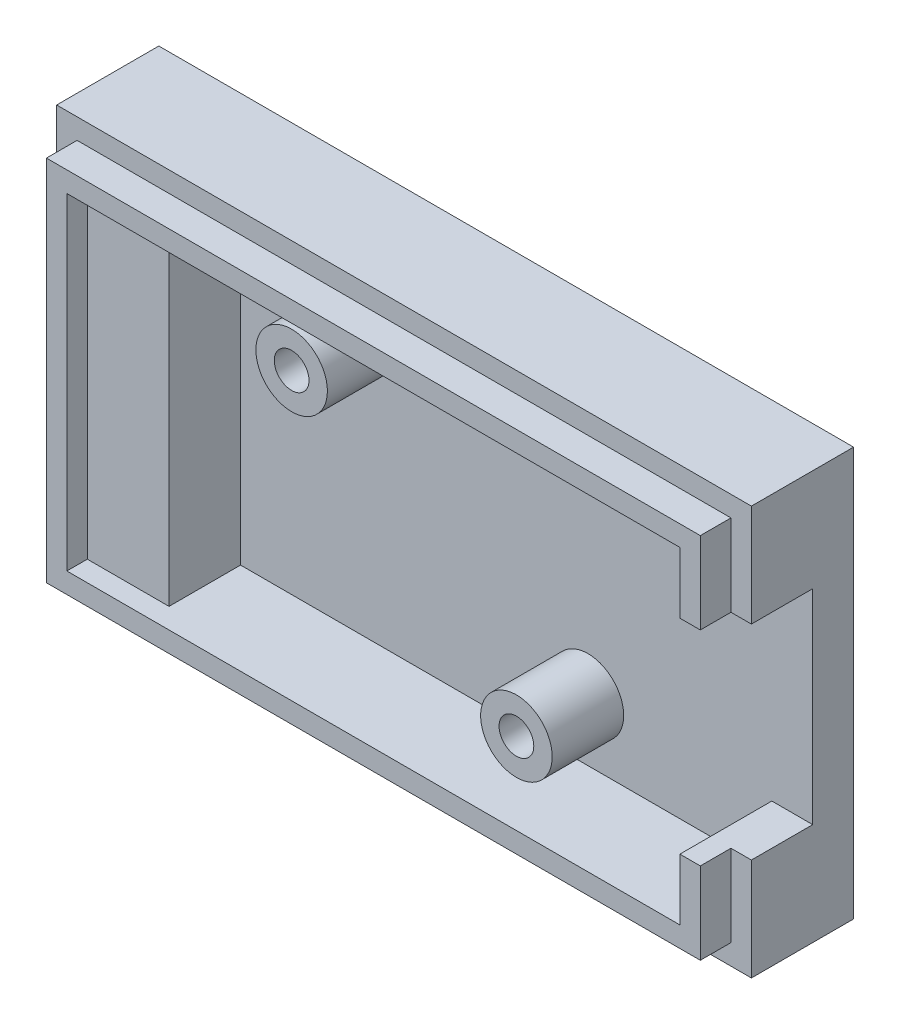
from build123d import *

# Parameters (mm, degrees)
SKETCH_1_W          = 34
SKETCH_1_H          = 20
EXTRUDE_1_DEPTH     = 6.5
SKETCH_2_W          = 30
SKETCH_2_H          = 16
CUT_EXTRUDE_1_DEPTH = 4.5
SKETCH_3_W          = 4.5
SKETCH_3_H          = 10
CUT_EXTRUDE_2_DEPTH = 2
CUT_EXTRUDE_3_DEPTH = 1.5
SKETCH_5_W          = 4
SKETCH_5_H          = 16
EXTRUDE_2_DEPTH     = 3.5
SKETCH_6_R          = 1.75
EXTRUDE_3_DEPTH     = 3.5
SKETCH_7_R          = 0.85
CUT_EXTRUDE_4_DEPTH = 21.475595229
SKETCH_8_R          = 1.5
CUT_EXTRUDE_5_DEPTH = 1


with BuildPart() as part:
    # 草图1 → 凸台-拉伸1 (new body)
    with BuildSketch(Plane.XY):
        Rectangle(SKETCH_1_W, SKETCH_1_H)
    extrude(amount=EXTRUDE_1_DEPTH)

    # 草图2 → 切除-拉伸1 (cut)
    with BuildSketch(Plane.XY.offset(6.5)):
        Rectangle(SKETCH_2_W, SKETCH_2_H)
    extrude(amount=-CUT_EXTRUDE_1_DEPTH, mode=Mode.SUBTRACT)

    # 草图3 → 切除-拉伸2 (cut)
    with BuildSketch(Plane(origin=(17, 0, 0), x_dir=(0, 0, -1), z_dir=(1, 0, 0))):
        with Locations((-4.25, 0)):
            Rectangle(SKETCH_3_W, SKETCH_3_H)
    extrude(amount=-CUT_EXTRUDE_2_DEPTH, mode=Mode.SUBTRACT)

    # 草图4 → 切除-拉伸3 (cut)
    with BuildSketch(Plane.XY.offset(6.5)):
        Polygon((16, 5), (16, 9), (-16, 9), (-16, -9), (16, -9), (16, -5), (17, -5), (17, -10), (-17, -10), (-17, 10), (17, 10), (17, 5), align=None)
    extrude(amount=-CUT_EXTRUDE_3_DEPTH, mode=Mode.SUBTRACT)

    # 草图5 → 凸台-拉伸2 (add)
    with BuildSketch(Plane.XY.offset(2)):
        with Locations((-13, 0)):
            Rectangle(SKETCH_5_W, SKETCH_5_H)
    extrude(amount=EXTRUDE_2_DEPTH)

    # 草图6 → 凸台-拉伸3 (add)
    with BuildSketch(Plane.XY.offset(2)):
        with Locations((-5, 5)):
            Circle(SKETCH_6_R)
        with Locations((6, -5)):
            Circle(SKETCH_6_R)
    extrude(amount=EXTRUDE_3_DEPTH)

    # 草图7 → 切除-拉伸4 (cut, through all)
    with BuildSketch(Plane.XY.offset(5.5)):
        with Locations((-5, 5)):
            Circle(SKETCH_7_R)
        with Locations((6, -5)):
            Circle(SKETCH_7_R)
    extrude(amount=-CUT_EXTRUDE_4_DEPTH, mode=Mode.SUBTRACT)

    # 草图8 → 切除-拉伸5 (cut)
    with BuildSketch(Plane(origin=(0, 0, 0), x_dir=(-1, 0, 0), z_dir=(0, 0, -1))):
        with Locations((-6, -5)):
            Circle(SKETCH_8_R)
        with Locations((5, 5)):
            Circle(SKETCH_8_R)
    extrude(amount=-CUT_EXTRUDE_5_DEPTH, mode=Mode.SUBTRACT)


solid = part.part
